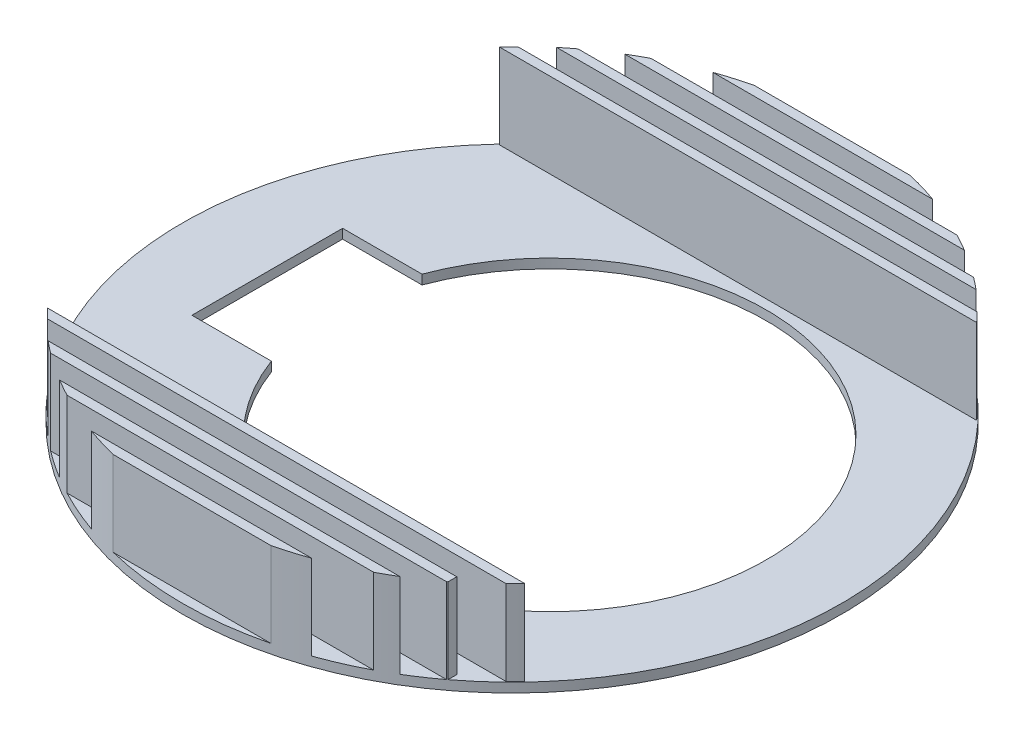
from build123d import *

# Parameters (mm, degrees)
SKETCH1_R           = 17.5
BOSS_EXTRUDE1_DEPTH = 0.5
SKETCH2_R           = 11.5
CUT_EXTRUDE1_DEPTH  = 0.5
SKETCH3_W           = 15
SKETCH3_H           = 8
CUT_EXTRUDE4_DEPTH  = 2.5
BOSS_EXTRUDE6_DEPTH = 4.5


with BuildPart() as part:
    # Sketch1 → Boss-Extrude1 (new body)
    with BuildSketch(Plane(origin=(0, 0, 0), x_dir=(1, 0, 0), z_dir=(0, 1, 0))):
        with Locations(Location((0, 0, 0), (0, 0, 270))):
            Circle(SKETCH1_R)
    extrude(amount=BOSS_EXTRUDE1_DEPTH)

    # Sketch2 → Cut-Extrude1 (cut)
    with BuildSketch(Plane(origin=(0, 0.5, 0), x_dir=(1, 0, 0), z_dir=(0, 1, 0))):
        with Locations(Location((2, 0, 0), (0, 0, 270))):
            Circle(SKETCH2_R)
    extrude(amount=-CUT_EXTRUDE1_DEPTH, mode=Mode.SUBTRACT)

    # Sketch3 → Cut-Extrude4 (cut)
    with BuildSketch(Plane(origin=(0, 0, 0), x_dir=(1, 0, 0), z_dir=(0, 1, 0))):
        with Locations((-5.5, 0)):
            Rectangle(SKETCH3_W, SKETCH3_H)
    extrude(amount=CUT_EXTRUDE4_DEPTH, mode=Mode.SUBTRACT)

    # Sketch7 → Boss-Extrude6 (add)
    with BuildSketch(Plane(origin=(0, 0.5, 0), x_dir=(1, 0, 0), z_dir=(0, 1, 0))):
        with BuildLine():
            Line((-11.135528726, 13.5), (11.135528726, 13.5))
            ThreePointArc((11.135528726, 13.5), (10.820652744, 13.753671299), (10.5, 14))
            Line((10.5, 14), (-10.5, 14))
            ThreePointArc((-10.5, 14), (-10.820652744, 13.753671299), (-11.135528726, 13.5))
        make_face()
        with BuildLine():
            Line((12.176537068, 12.5), (-12.176537068, 12.5))
            ThreePointArc((-12.176537068, 12.5), (-12.42556977, 12.252480192), (-12.669572012, 12))
            Line((-12.669572012, 12), (12.669572012, 12))
            ThreePointArc((12.669572012, 12), (12.42556977, 12.252480192), (12.176537068, 12.5))
        make_face()
        with BuildLine():
            ThreePointArc((-11.145229996, -13.491992008), (-10.830835088, -13.74565427), (-10.510668849, -13.991992008))
            Line((-10.510668849, -13.991992008), (10.510668849, -13.991992008))
            ThreePointArc((10.510668849, -13.991992008), (10.53333572, -13.974936086), (10.555974914, -13.957843444))
            Line((10.555974914, -13.957843444), (10.555974914, -13.491992008))
            Line((10.555974914, -13.491992008), (-11.145229996, -13.491992008))
        make_face()
        with BuildLine():
            Line((-9.013878189, 15), (9.013878189, 15))
            ThreePointArc((9.013878189, 15), (8.572604405, 15.256488905), (8.124038405, 15.5))
            Line((8.124038405, 15.5), (-8.124038405, 15.5))
            ThreePointArc((-8.124038405, 15.5), (-8.572604405, 15.256488905), (-9.013878189, 15))
        make_face()
        with BuildLine():
            ThreePointArc((-9.027190906, -14.991992008), (-8.586884855, -15.248455938), (-8.139298719, -15.491992008))
            Line((-8.139298719, -15.491992008), (8.139298719, -15.491992008))
            ThreePointArc((8.139298719, -15.491992008), (8.586884855, -15.248455938), (9.027190906, -14.991992008))
            Line((9.027190906, -14.991992008), (-9.027190906, -14.991992008))
        make_face()
        with BuildLine():
            Line((-5.830951895, 16.5), (5.830951895, 16.5))
            ThreePointArc((5.830951895, 16.5), (4.998387844, 16.770990399), (4.153311931, 17))
            Line((4.153311931, 17), (-4.153311931, 17))
            ThreePointArc((-4.153311931, 17), (-4.998387844, 16.770990399), (-5.830951895, 16.5))
        make_face()
        with BuildLine():
            Line((5.853562985, -16.491992008), (-5.853562985, -16.491992008))
            ThreePointArc((-5.853562985, -16.491992008), (-5.025979841, -16.762742217), (-4.185953609, -16.991992008))
            Line((-4.185953609, -16.991992008), (4.185953609, -16.991992008))
            ThreePointArc((4.185953609, -16.991992008), (5.025979841, -16.762742217), (5.853562985, -16.491992008))
        make_face()
        with BuildLine():
            Line((12.669572012, -12), (-12.669572012, -12))
            ThreePointArc((-12.669572012, -12), (-12.42556977, -12.252480192), (-12.176537068, -12.5))
            Line((-12.176537068, -12.5), (12.176537068, -12.5))
            ThreePointArc((12.176537068, -12.5), (12.42556977, -12.252480192), (12.669572012, -12))
        make_face()
    extrude(amount=BOSS_EXTRUDE6_DEPTH)


solid = part.part
